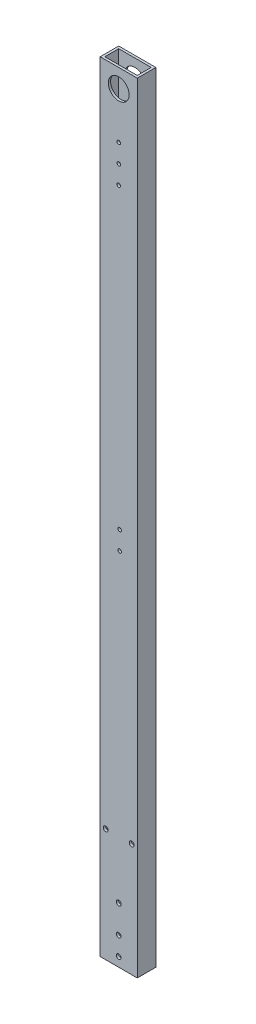
from build123d import *

# Parameters (mm, degrees)
SKETCH1_W           = 50.8
SKETCH1_H           = 25.4
SKETCH1_W_2         = 44.45
SKETCH1_H_2         = 19.05
BOSS_EXTRUDE1_DEPTH = 1066.8
SKETCH2_R           = 14.2875
CUT_EXTRUDE1_DEPTH  = 1068.404590584
SKETCH3_R           = 3.175
CUT_EXTRUDE2_DEPTH  = 1068.404590584
SKETCH4_R           = 2.4638
CUT_EXTRUDE3_DEPTH  = 1068.404590584
SKETCH5_R           = 3.3734375
CUT_EXTRUDE4_DEPTH  = 1068.404590584
SKETCH6_R           = 3.3734375
CUT_EXTRUDE5_DEPTH  = 1068.404590584


with BuildPart() as part:
    # Sketch1 → Boss-Extrude1 (new body)
    with BuildSketch(Plane(origin=(0, 0, 0), x_dir=(1, 0, 0), z_dir=(0, 1, 0))):
        Rectangle(SKETCH1_W, SKETCH1_H)
        Rectangle(SKETCH1_W_2, SKETCH1_H_2, mode=Mode.SUBTRACT)
    extrude(amount=BOSS_EXTRUDE1_DEPTH)

    # Sketch2 → Cut-Extrude1 (cut, through all)
    with BuildSketch(Plane.XY.offset(12.7)):
        with Locations((0, 1041.4)):
            Circle(SKETCH2_R)
    extrude(amount=-CUT_EXTRUDE1_DEPTH, mode=Mode.SUBTRACT)

    # Sketch3 → Cut-Extrude2 (cut, through all)
    with BuildSketch(Plane.XY.offset(12.7)):
        with Locations((0, 12.7)):
            Circle(SKETCH3_R)
        with Locations((0, 38.1)):
            Circle(SKETCH3_R)
    extrude(amount=-CUT_EXTRUDE2_DEPTH, mode=Mode.SUBTRACT)

    # Sketch4 → Cut-Extrude3 (cut, through all)
    with BuildSketch(Plane.XY.offset(12.7)):
        with Locations((0, 977.9)):
            Circle(SKETCH4_R)
        with Locations((0, 952.5)):
            Circle(SKETCH4_R)
        with Locations((0, 927.1)):
            Circle(SKETCH4_R)
        with Locations((1.27, 519.585439926)):
            Circle(SKETCH4_R)
        with Locations((1.27, 494.185439926)):
            Circle(SKETCH4_R)
    extrude(amount=-CUT_EXTRUDE3_DEPTH, mode=Mode.SUBTRACT)

    # Sketch5 → Cut-Extrude4 (cut, through all)
    with BuildSketch(Plane.XY.offset(12.7)):
        with Locations((0, 76.2)):
            Circle(SKETCH5_R)
    extrude(amount=-CUT_EXTRUDE4_DEPTH, mode=Mode.SUBTRACT)

    # Sketch6 → Cut-Extrude5 (cut, through all)
    with BuildSketch(Plane.XY.offset(12.7)):
        with Locations((-17.78, 155.17537)):
            Circle(SKETCH6_R)
        with Locations((17.78, 155.17537)):
            Circle(SKETCH6_R)
    extrude(amount=-CUT_EXTRUDE5_DEPTH, mode=Mode.SUBTRACT)


solid = part.part
